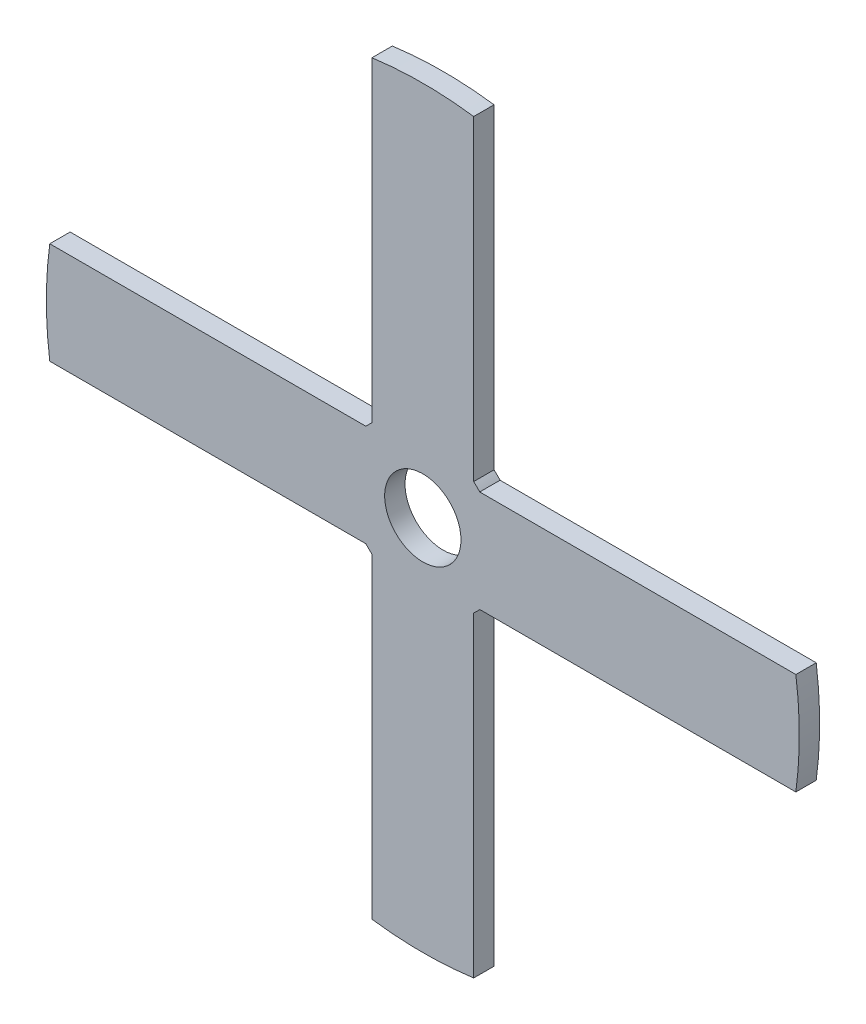
from build123d import *

# Parameters (mm, degrees)
SKETCH1_R           = 15
BOSS_EXTRUDE1_DEPTH = 8


with BuildPart() as part:
    # Sketch1 → Boss-Extrude1 (new body)
    with BuildSketch(Plane.XY):
        with BuildLine():
            Line((20, 22.360679775), (20, 146.642422239))
            ThreePointArc((20, 146.642422239), (0, 148), (-20, 146.642422239))
            Line((-20, 146.642422239), (-20, 22.360679775))
            ThreePointArc((-20, 22.360679775), (-21.213203436, 21.213203436), (-22.360679775, 20))
            Line((-22.360679775, 20), (-146.642422239, 20))
            ThreePointArc((-146.642422239, 20), (-148, 0), (-146.642422239, -20))
            Line((-146.642422239, -20), (-22.360679775, -20))
            ThreePointArc((-22.360679775, -20), (-21.213203436, -21.213203436), (-20, -22.360679775))
            Line((-20, -22.360679775), (-20, -146.642422239))
            ThreePointArc((-20, -146.642422239), (0, -148), (20, -146.642422239))
            Line((20, -146.642422239), (20, -22.360679775))
            ThreePointArc((20, -22.360679775), (21.213203436, -21.213203436), (22.360679775, -20))
            Line((22.360679775, -20), (146.642422239, -20))
            ThreePointArc((146.642422239, -20), (148, 0), (146.642422239, 20))
            Line((146.642422239, 20), (22.360679775, 20))
            ThreePointArc((22.360679775, 20), (21.213203436, 21.213203436), (20, 22.360679775))
        make_face()
        Circle(SKETCH1_R, mode=Mode.SUBTRACT)
    extrude(amount=BOSS_EXTRUDE1_DEPTH)


solid = part.part
